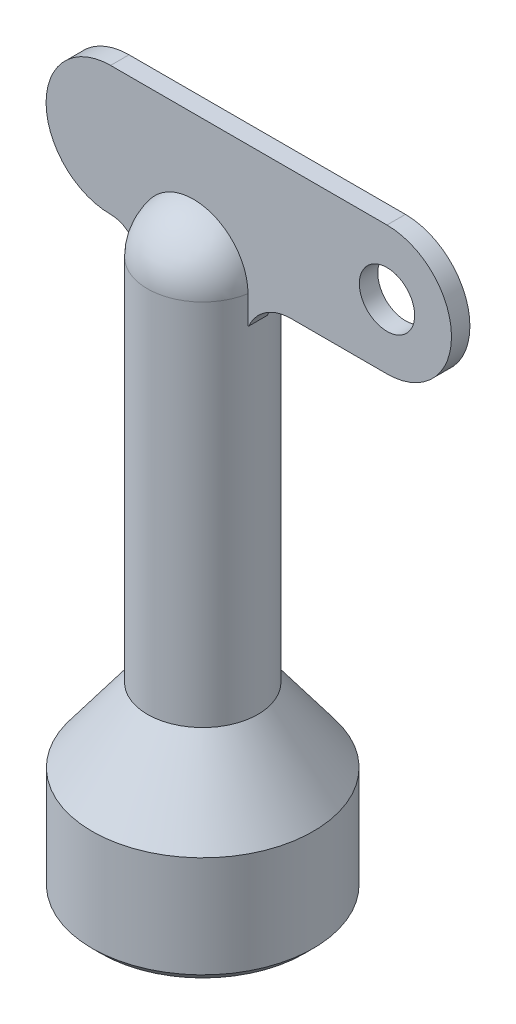
from build123d import *

# Parameters (mm, degrees)
SKETCH_1_R          = 6
EXTRUDE_1_DEPTH     = 6
SKETCH_2_R          = 3
SKETCH_1_2_R        = 6
SKETCH_2_2_R        = 3
EXTRUDE_2_DEPTH     = 20
EXTRUDE_4_DEPTH     = 0.5
SKETCH_8_R          = 1.5
CUT_EXTRUDE_1_DEPTH = 35.630189161
CUT_EXTRUDE_2_DEPTH = 5
CHAMFER_1_SIZE      = 0.5
CHAMFER_1_SIZE2     = 0.288675135
CHAMFER_2_SIZE      = 0.5


with BuildPart() as part:
    # 草图1 → 凸台-拉伸1 (new body)
    with BuildSketch(Plane(origin=(0, 0, 0), x_dir=(1, 0, 0), z_dir=(0, 1, 0))):
        with Locations(Location((0, 0, 0), (0, 0, 270))):
            Circle(SKETCH_1_R)
    extrude(amount=-EXTRUDE_1_DEPTH)

    # 草图2 → 放样1 section 0
    with BuildSketch(Plane(origin=(0, 4, 0), x_dir=(1, 0, 0), z_dir=(0, 1, 0))):
        Circle(SKETCH_2_R)
    # 草图1<2> → 放样1 section 1
    with BuildSketch(Plane(origin=(0, 0, 0), x_dir=(1, 0, 0), z_dir=(0, 1, 0))):
        Circle(SKETCH_1_2_R)
    loft()

    # 草图2<2> → 凸台-拉伸2 (add)
    with BuildSketch(Plane(origin=(0, 4, 0), x_dir=(1, 0, 0), z_dir=(0, 1, 0))):
        with Locations(Location((0, 0, 0), (0, 0, 270))):
            Circle(SKETCH_2_2_R)
    extrude(amount=EXTRUDE_2_DEPTH)

    # 草图7 → 旋转2 (revolve)
    with BuildSketch(Plane.XY, mode=Mode.PRIVATE) as revolve_2_sk:
        with BuildLine():
            Line((-3, 24), (0, 24))
            Line((0, 24), (0, 27))
            ThreePointArc((0, 27), (-2.121320344, 26.121320344), (-3, 24))
        make_face()
    revolve(revolve_2_sk.sketch.rotate(Axis((0, 0, 0), (0, 1, 0)), 90), axis=Axis((0, 0, 0), (0, 1, 0)))

    # 草图5 → 凸台-拉伸4 (add, symmetric)
    with BuildSketch(Plane.XY):
        with BuildLine():
            Line((-3, 22.5), (3, 22.5))
            ThreePointArc((3, 22.5), (3.921981454, 23.591650066), (5.291287847, 24))
            Line((5.291287847, 24), (10.5, 24))
            ThreePointArc((10.5, 24), (14, 27.5), (10.5, 31))
            Line((10.5, 31), (-4.5, 31))
            ThreePointArc((-4.5, 31), (-8, 27.5), (-4.5, 24))
            ThreePointArc((-4.5, 24), (-3.439339828, 23.560660172), (-3, 22.5))
        make_face()
    extrude(amount=EXTRUDE_4_DEPTH, both=True)

    # 草图8 → 切除-拉伸1 (cut, through all)
    with BuildSketch(Plane.XY.offset(0.5)):
        with Locations((10.5, 27.5)):
            Circle(SKETCH_8_R)
    extrude(amount=-CUT_EXTRUDE_1_DEPTH, mode=Mode.SUBTRACT)

    # 草图9 → 切除-拉伸2 (cut)
    with BuildSketch(Plane.XZ.offset(6)):
        with BuildLine():
            Line((-0.173205081, 4.7), (-4.156921938, -2.2))
            ThreePointArc((-4.156921938, -2.2), (-4.156921938, -2.4), (-3.983716857, -2.5))
            Line((-3.983716857, -2.5), (3.983716857, -2.5))
            ThreePointArc((3.983716857, -2.5), (4.156921938, -2.4), (4.156921938, -2.2))
            Line((4.156921938, -2.2), (0.173205081, 4.7))
            ThreePointArc((0.173205081, 4.7), (0, 4.8), (-0.173205081, 4.7))
        make_face()
    extrude(amount=-CUT_EXTRUDE_2_DEPTH, mode=Mode.SUBTRACT)

    # 倒角1
    chamfer_1_edges = [part.edges().sort_by_distance(p)[0] for p in [
        (4.156921938, -6, -2.4),
        (2.165063509, -6, 1.25),
        (0, -6, 4.8),
        (-2.165063509, -6, 1.25),
        (-4.156921938, -6, -2.4),
        (0, -6, -2.5),
    ]]
    chamfer_1_side = [part.faces().sort_by_distance(p)[0] for p in [
        (0, -6, -5.830294373),
    ]]
    chamfer(chamfer_1_edges, length=CHAMFER_1_SIZE, length2=CHAMFER_1_SIZE2, reference=chamfer_1_side[0])

    # 倒角2
    chamfer_2_edges = [part.edges().sort_by_distance(p)[0] for p in [
        (0, -6, -6),
    ]]
    chamfer(chamfer_2_edges, length=CHAMFER_2_SIZE)


solid = part.part
